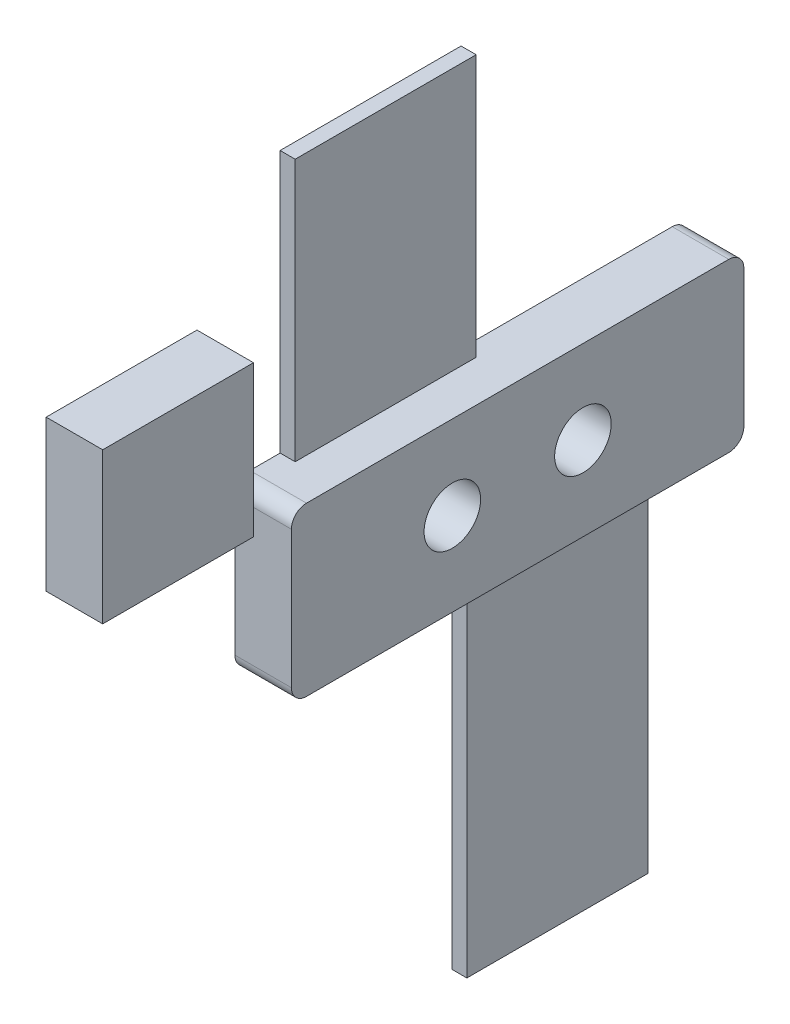
from build123d import *

# Parameters (mm, degrees)
SKETCH1_W           = 38.1
SKETCH1_H           = 14.097
BOSS_EXTRUDE1_DEPTH = 4.7625
FILLET1_R           = 1.27
SKETCH2_R           = 2.38125
CUT_EXTRUDE1_DEPTH  = 4.7625
SKETCH3_W           = 12.7
SKETCH3_H           = 12.7
BOSS_EXTRUDE2_DEPTH = 4.7625
SKETCH4_W           = 15.24
SKETCH4_H           = 22.067088611
SKETCH4_H_2         = 30.779638622
BOSS_EXTRUDE3_DEPTH = 1.27


with BuildPart() as part:
    # Sketch1 → Boss-Extrude1 (new body)
    with BuildSketch(Plane(origin=(0, 0, 0), x_dir=(0, 0, -1), z_dir=(1, 0, 0))):
        Rectangle(SKETCH1_W, SKETCH1_H)
    extrude(amount=BOSS_EXTRUDE1_DEPTH)

    # Fillet1
    fillet1_edges = [part.edges().sort_by_distance(p)[0] for p in [
        (2.38125, 7.0485, 19.05),
        (2.38125, 7.0485, -19.05),
        (2.38125, -7.0485, -19.05),
        (2.38125, -7.0485, 19.05),
    ]]
    fillet(fillet1_edges, radius=FILLET1_R)

    # Sketch2 → Cut-Extrude1 (cut)
    with BuildSketch(Plane(origin=(4.7625, 0, 0), x_dir=(0, 0, -1), z_dir=(1, 0, 0))):
        with Locations((-5.4991, 0)):
            Circle(SKETCH2_R)
        with Locations((5.4991, 0)):
            Circle(SKETCH2_R)
    extrude(amount=-CUT_EXTRUDE1_DEPTH, mode=Mode.SUBTRACT)

    # Sketch4 → Boss-Extrude3 (add)
    with BuildSketch(Plane.ZY):
        with Locations((7.62, 18.082044306)):
            Rectangle(SKETCH4_W, SKETCH4_H)
        with Locations((-6.836682106, -22.438319311)):
            Rectangle(SKETCH4_W, SKETCH4_H_2)
    extrude(amount=-BOSS_EXTRUDE3_DEPTH)


with BuildPart() as body_2:
    # Sketch3 → Boss-Extrude2 (new body)
    with BuildSketch(Plane.ZY):
        with Locations((28.59110019, 13.170447646)):
            Rectangle(SKETCH3_W, SKETCH3_H)
    extrude(amount=-BOSS_EXTRUDE2_DEPTH)


solid = Compound([part.part, body_2.part])
